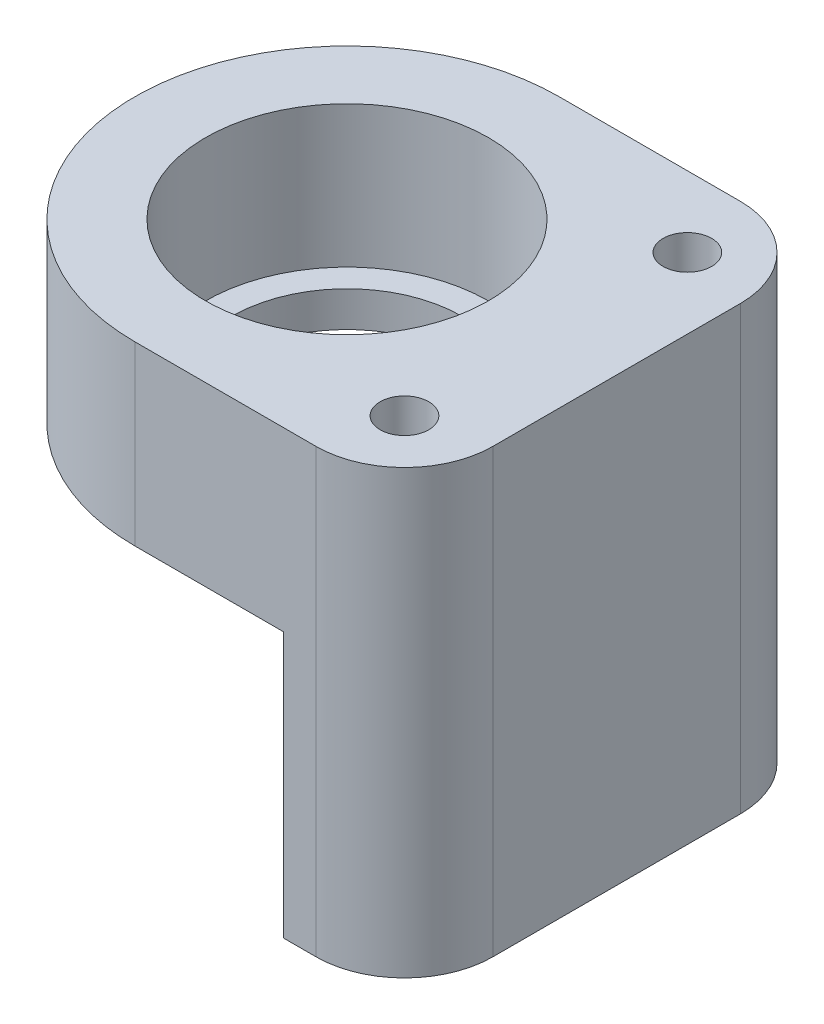
from build123d import *

# Parameters (mm, degrees)
BOSS_EXTRUDE1_DEPTH       = 50
CUT_EXTRUDE1_DEPTH        = 30
F_3_0MM_DOWEL_HOLE1_D     = 3
F_3_0MM_DOWEL_HOLE1_DEPTH = 6
F_3_0MM_DOWEL_HOLE1_TIP   = 0.901290929
M5_CLEARANCE_HOLE1_D      = 5.5


with BuildPart() as part:
    # Sketch1 → Revolve1 (revolve)
    with BuildSketch(Plane.XY, mode=Mode.PRIVATE) as revolve1_sk:
        Polygon((-24, 0), (-24, 50), (-16, 50), (-16, 34), (-13, 34), (-13, 30), (-16, 30), (-20, 30), (-20, 0), align=None)
    revolve(revolve1_sk.sketch.rotate(Axis((0, 0, 0), (0, 1, 0)), 270), axis=Axis((0, 0, 0), (0, 1, 0)))

    # Sketch6 → Boss-Extrude1 (add)
    with BuildSketch(Plane(origin=(0, 50, 0), x_dir=(1, 0, 0), z_dir=(0, 1, 0))):
        with BuildLine():
            Line((0, -24), (20.5, -24))
            ThreePointArc((20.5, -24), (27.571067812, -21.071067812), (30.5, -14))
            Line((30.5, -14), (30.5, 14))
            ThreePointArc((30.5, 14), (27.571067812, 21.071067812), (20.5, 24))
            Line((20.5, 24), (0, 24))
            ThreePointArc((0, 24), (24, 0), (0, -24))
        make_face()
    extrude(amount=-BOSS_EXTRUDE1_DEPTH)

    # Sketch5 → Cut-Extrude1 (cut)
    with BuildSketch(Plane(origin=(0, 0, 0), x_dir=(1, 0, 0), z_dir=(0, 1, 0))):
        Polygon((15.085272612, -18.666401641), (20.483393436, -35.301209276), (-37.381072525, -18.770693037), (-37.381072525, 22.982117566), (-6.915364934, 22.982117566), (0, 0), align=None)
    extrude(amount=CUT_EXTRUDE1_DEPTH, mode=Mode.SUBTRACT)

    # Ø3.0mm Dowel Hole1
    with Locations(Plane(origin=(0, 0, 0), x_dir=(-1, 0, 0), z_dir=(0, -1, 0))):
        with Locations((-24.5, -9), (-24.5, 9)):
            Hole(F_3_0MM_DOWEL_HOLE1_D / 2, depth=F_3_0MM_DOWEL_HOLE1_DEPTH)
            with Locations((0, 0, -(F_3_0MM_DOWEL_HOLE1_DEPTH + F_3_0MM_DOWEL_HOLE1_TIP / 2))):  # 118° drill point
                Cone(0, F_3_0MM_DOWEL_HOLE1_D / 2, F_3_0MM_DOWEL_HOLE1_TIP, mode=Mode.SUBTRACT)

    # M5 Clearance Hole1 (through all)
    with Locations(Plane(origin=(0, 0, 0), x_dir=(-1, 0, 0), z_dir=(0, -1, 0))):
        with Locations((-22.5, -16), (-22.5, 16)):
            Hole(M5_CLEARANCE_HOLE1_D / 2)


solid = part.part
